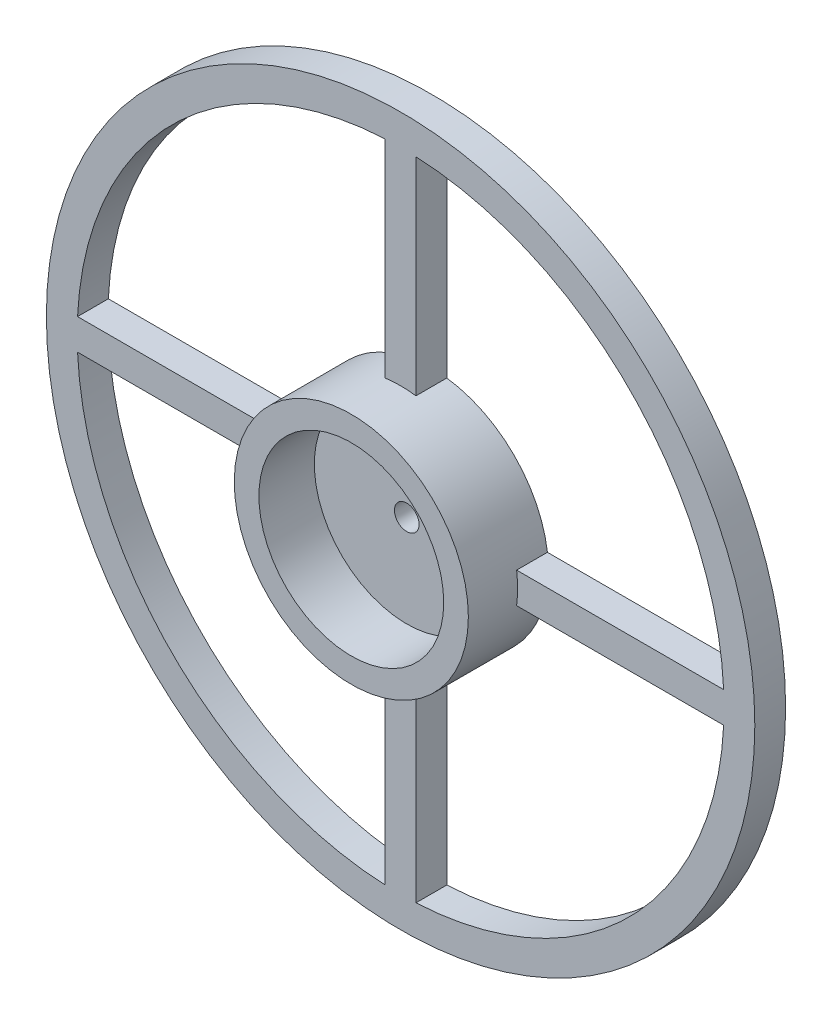
from build123d import *

# Parameters (mm, degrees)
SKETCH1_R           = 57.5
SKETCH1_R_2         = 2
BOSS_EXTRUDE1_DEPTH = 5
SKETCH2_R           = 15
CUT_EXTRUDE1_DEPTH  = 1
SKETCH3_R           = 19
SKETCH3_R_2         = 15
BOSS_EXTRUDE3_DEPTH = 8


with BuildPart() as part:
    # Sketch1 → Boss-Extrude1 (new body)
    # profile 1 of 6: a face of its own
    with BuildSketch(Plane.XY):
        Circle(SKETCH1_R)
        with BuildLine():
            ThreePointArc((-52.440442409, 2.5), (-37.123106012, 37.123106012), (-2.5, 52.440442409))
            Line((-2.5, 52.440442409), (-2.5, 18.834808202))
            ThreePointArc((-2.5, 18.834808202), (0, 19), (2.5, 18.834808202))
            Line((2.5, 18.834808202), (2.5, 52.440442409))
            ThreePointArc((2.5, 52.440442409), (37.123106012, 37.123106012), (52.440442409, 2.5))
            Line((52.440442409, 2.5), (18.834808202, 2.5))
            ThreePointArc((18.834808202, 2.5), (18.958657071, 1.252725861), (19, 0))
            ThreePointArc((19, 0), (18.958657071, -1.252725861), (18.834808202, -2.5))
            Line((18.834808202, -2.5), (52.440442409, -2.5))
            ThreePointArc((52.440442409, -2.5), (37.123106012, -37.123106012), (2.5, -52.440442409))
            Line((2.5, -52.440442409), (2.5, -18.834808202))
            ThreePointArc((2.5, -18.834808202), (0, -19), (-2.5, -18.834808202))
            Line((-2.5, -18.834808202), (-2.5, -52.440442409))
            ThreePointArc((-2.5, -52.440442409), (-37.123106012, -37.123106012), (-52.440442409, -2.5))
            Line((-52.440442409, -2.5), (-18.834808202, -2.5))
            ThreePointArc((-18.834808202, -2.5), (-19, 0), (-18.834808202, 2.5))
            Line((-18.834808202, 2.5), (-52.440442409, 2.5))
        make_face(mode=Mode.SUBTRACT)
    # profile 2 of 6: a face of its own
    with BuildSketch(Plane.XY):
        with BuildLine():
            Line((-2.5, 14.790199458), (-2.5, 18.834808202))
            ThreePointArc((-2.5, 18.834808202), (-13.435028843, 13.435028843), (-18.834808202, 2.5))
            Line((-18.834808202, 2.5), (-14.790199458, 2.5))
            ThreePointArc((-14.790199458, 2.5), (-10.606601718, 10.606601718), (-2.5, 14.790199458))
        make_face()
    # profile 3 of 6: a face of its own
    with BuildSketch(Plane.XY):
        with BuildLine():
            Line((-14.790199458, -2.5), (-18.834808202, -2.5))
            ThreePointArc((-18.834808202, -2.5), (-13.435028843, -13.435028843), (-2.5, -18.834808202))
            Line((-2.5, -18.834808202), (-2.5, -14.790199458))
            ThreePointArc((-2.5, -14.790199458), (-10.606601718, -10.606601718), (-14.790199458, -2.5))
        make_face()
    # profile 4 of 6: a face of its own
    with BuildSketch(Plane.XY):
        with BuildLine():
            ThreePointArc((2.5, 18.834808202), (0, 19), (-2.5, 18.834808202))
            Line((-2.5, 18.834808202), (-2.5, 14.790199458))
            ThreePointArc((-2.5, 14.790199458), (-10.606601718, 10.606601718), (-14.790199458, 2.5))
            Line((-14.790199458, 2.5), (-18.834808202, 2.5))
            ThreePointArc((-18.834808202, 2.5), (-19, 0), (-18.834808202, -2.5))
            Line((-18.834808202, -2.5), (-14.790199458, -2.5))
            ThreePointArc((-14.790199458, -2.5), (-10.606601718, -10.606601718), (-2.5, -14.790199458))
            Line((-2.5, -14.790199458), (-2.5, -18.834808202))
            ThreePointArc((-2.5, -18.834808202), (0, -19), (2.5, -18.834808202))
            Line((2.5, -18.834808202), (2.5, -14.790199458))
            ThreePointArc((2.5, -14.790199458), (10.606601718, -10.606601718), (14.790199458, -2.5))
            Line((14.790199458, -2.5), (18.834808202, -2.5))
            ThreePointArc((18.834808202, -2.5), (18.958657071, -1.252725861), (19, 0))
            ThreePointArc((19, 0), (18.958657071, 1.252725861), (18.834808202, 2.5))
            Line((18.834808202, 2.5), (14.790199458, 2.5))
            ThreePointArc((14.790199458, 2.5), (10.606601718, 10.606601718), (2.5, 14.790199458))
            Line((2.5, 14.790199458), (2.5, 18.834808202))
        make_face()
        Circle(SKETCH1_R_2, mode=Mode.SUBTRACT)
    # profile 5 of 6: a face of its own
    with BuildSketch(Plane.XY):
        with BuildLine():
            ThreePointArc((18.834808202, 2.5), (13.435028843, 13.435028843), (2.5, 18.834808202))
            Line((2.5, 18.834808202), (2.5, 14.790199458))
            ThreePointArc((2.5, 14.790199458), (10.606601718, 10.606601718), (14.790199458, 2.5))
            Line((14.790199458, 2.5), (18.834808202, 2.5))
        make_face()
    # profile 6 of 6: a face of its own
    with BuildSketch(Plane.XY):
        with BuildLine():
            ThreePointArc((2.5, -18.834808202), (13.435028843, -13.435028843), (18.834808202, -2.5))
            Line((18.834808202, -2.5), (14.790199458, -2.5))
            ThreePointArc((14.790199458, -2.5), (10.606601718, -10.606601718), (2.5, -14.790199458))
            Line((2.5, -14.790199458), (2.5, -18.834808202))
        make_face()
    extrude(amount=BOSS_EXTRUDE1_DEPTH)

    # Sketch2 → Cut-Extrude1 (cut)
    with BuildSketch(Plane.XY.offset(5)):
        Circle(SKETCH2_R)
    extrude(amount=-CUT_EXTRUDE1_DEPTH, mode=Mode.SUBTRACT)

    # Sketch3 → Boss-Extrude3 (add)
    with BuildSketch(Plane.XY.offset(5)):
        with Locations(Location((0, 0, 0), (0, 0, 172.439156823))):
            Circle(SKETCH3_R)
        Circle(SKETCH3_R_2, mode=Mode.SUBTRACT)
    extrude(amount=BOSS_EXTRUDE3_DEPTH)


solid = part.part
